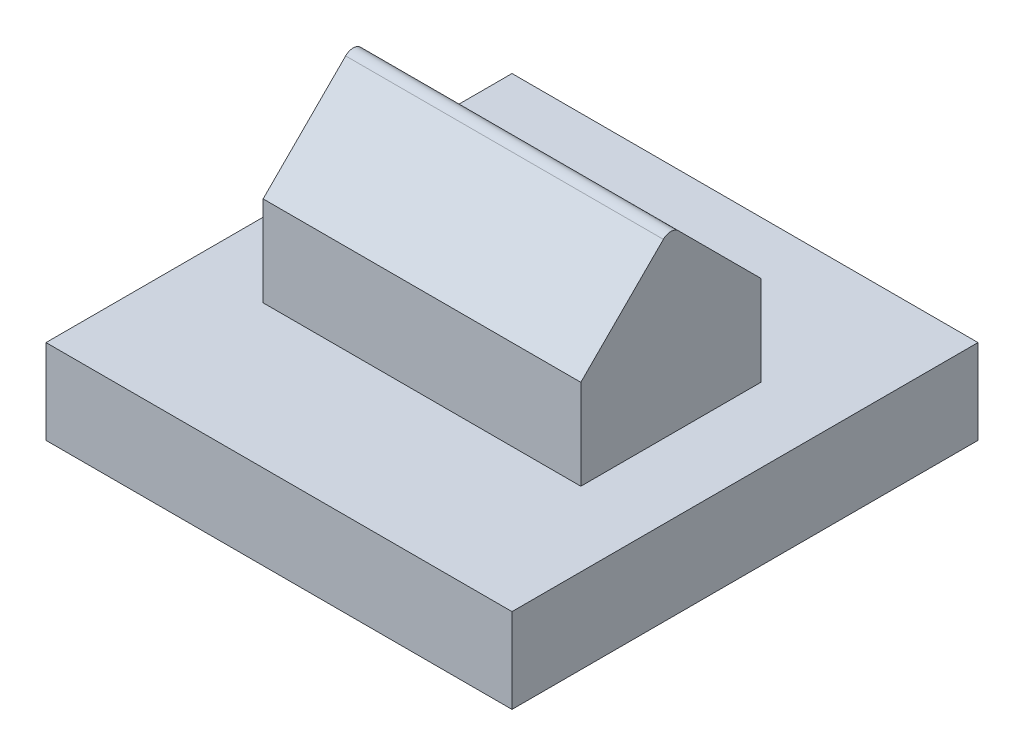
from build123d import *

# Parameters (mm, degrees)
RESSALTO_EXTRUS_O1_DEPTH      = 22
RESSALTO_EXTRUS_O1_DEPTH_BACK = 22
RESSALTO_EXTRUS_O2_DEPTH      = 15
RESSALTO_EXTRUS_O2_DEPTH_BACK = 15


with BuildPart() as part:
    # Esboço2 → Ressalto-extrusão1 (new, two sides: drawn at the far end of the back side and taken through both)
    with BuildSketch(Plane.XY.offset(-RESSALTO_EXTRUS_O1_DEPTH_BACK)):
        Polygon((0, 0), (22, 0), (22, -8), (0, -8), (-22, -8), (-22, 0), align=None)
    extrude(amount=RESSALTO_EXTRUS_O1_DEPTH + RESSALTO_EXTRUS_O1_DEPTH_BACK)

    # Esboço4 → Ressalto-extrusão2 (add, two sides: drawn at the far end of the back side and taken through both)
    with BuildSketch(Plane(origin=(0, 0, 0), x_dir=(0, 0, -1), z_dir=(1, 0, 0)).offset(-RESSALTO_EXTRUS_O2_DEPTH_BACK)):
        with BuildLine():
            Line((-8.5, 8.5), (-0.707106781, 16.292893219))
            ThreePointArc((-0.707106781, 16.292893219), (0, 16.585786438), (0.707106781, 16.292893219))
            Line((0.707106781, 16.292893219), (8.5, 8.5))
            Line((8.5, 8.5), (8.5, 0))
            Line((8.5, 0), (0, 0))
            Line((0, 0), (-8.5, 0))
            Line((-8.5, 0), (-8.5, 8.5))
        make_face()
    extrude(amount=RESSALTO_EXTRUS_O2_DEPTH + RESSALTO_EXTRUS_O2_DEPTH_BACK)


solid = part.part
